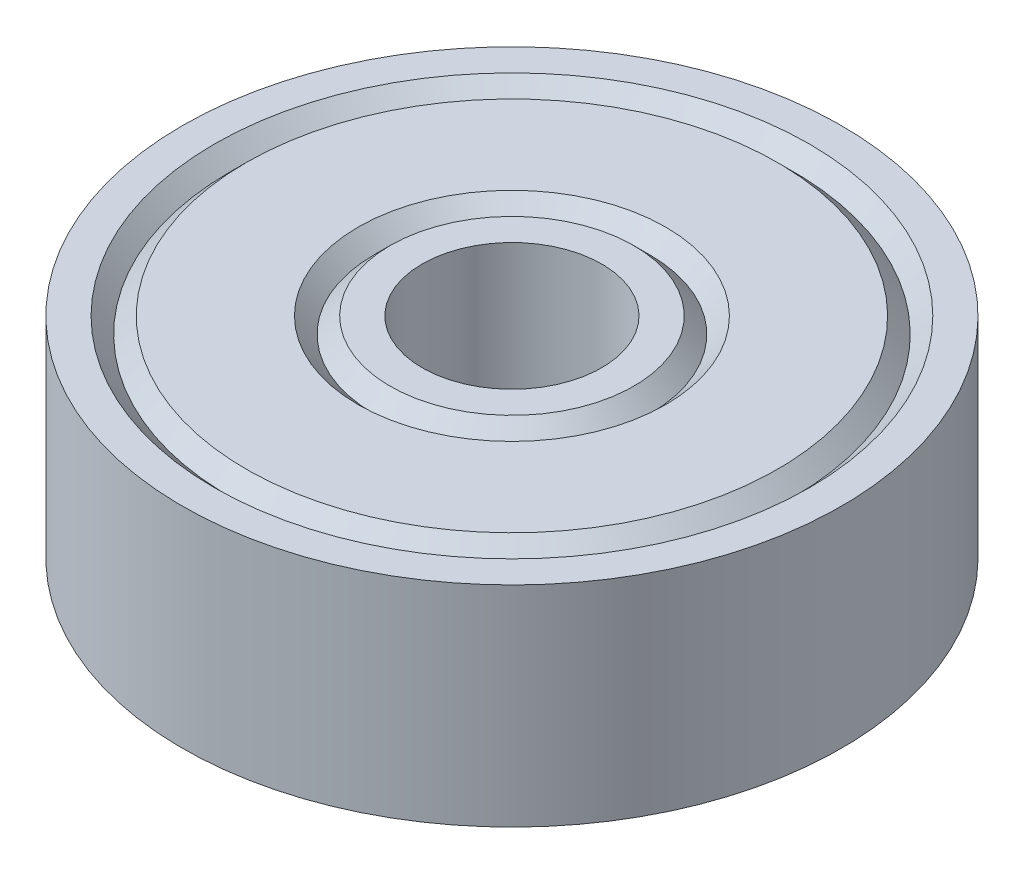
from build123d import *


with BuildPart() as part:
    # Sketch1 → Revolve1 (revolve)
    with BuildSketch(Plane.XY):
        Polygon((-3, 3.5), (-4.066666667, 3.5), (-4.6, 2.966666667), (-5.133333333, 3.5), (-8.866666667, 3.5), (-9.4, 2.966666667), (-9.933333333, 3.5), (-11, 3.5), (-11, -3.5), (-9.933333333, -3.5), (-9.4, -2.966666667), (-8.866666667, -3.5), (-5.133333333, -3.5), (-4.6, -2.966666667), (-4.066666667, -3.5), (-3, -3.5), align=None)
    revolve(axis=Axis((0, 3.5, 0), (0, -1, 0)))


solid = part.part
